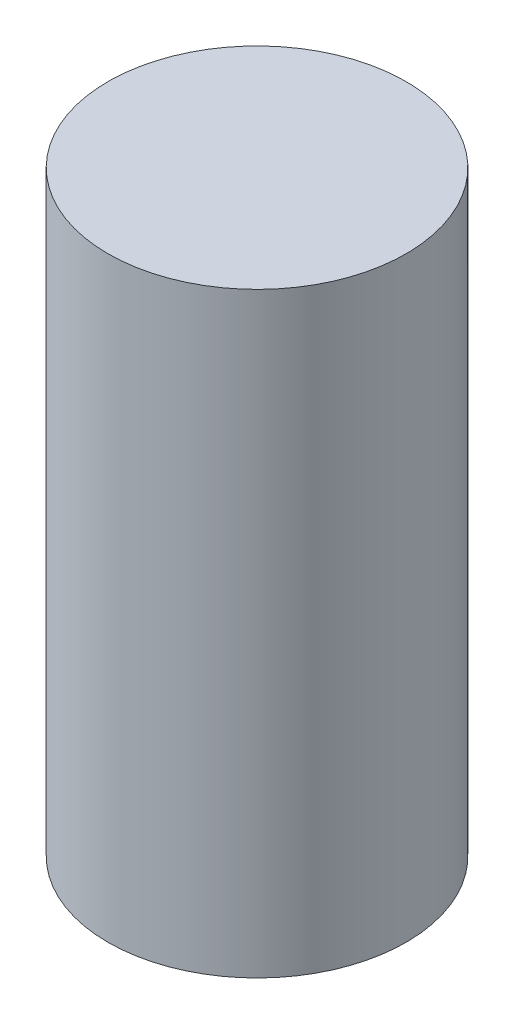
from build123d import *

# Parameters (mm, degrees)
SKETCH_1_R      = 12.5
EXTRUDE_1_DEPTH = 50


with BuildPart() as part:
    # Эскиз1 → Вытянуть1 (new body)
    with BuildSketch(Plane(origin=(0, 0, 0), x_dir=(1, 0, 0), z_dir=(0, 1, 0))):
        with Locations(Location((0, 0, 0), (0, 0, 270))):
            Circle(SKETCH_1_R)
    extrude(amount=EXTRUDE_1_DEPTH)


solid = part.part
